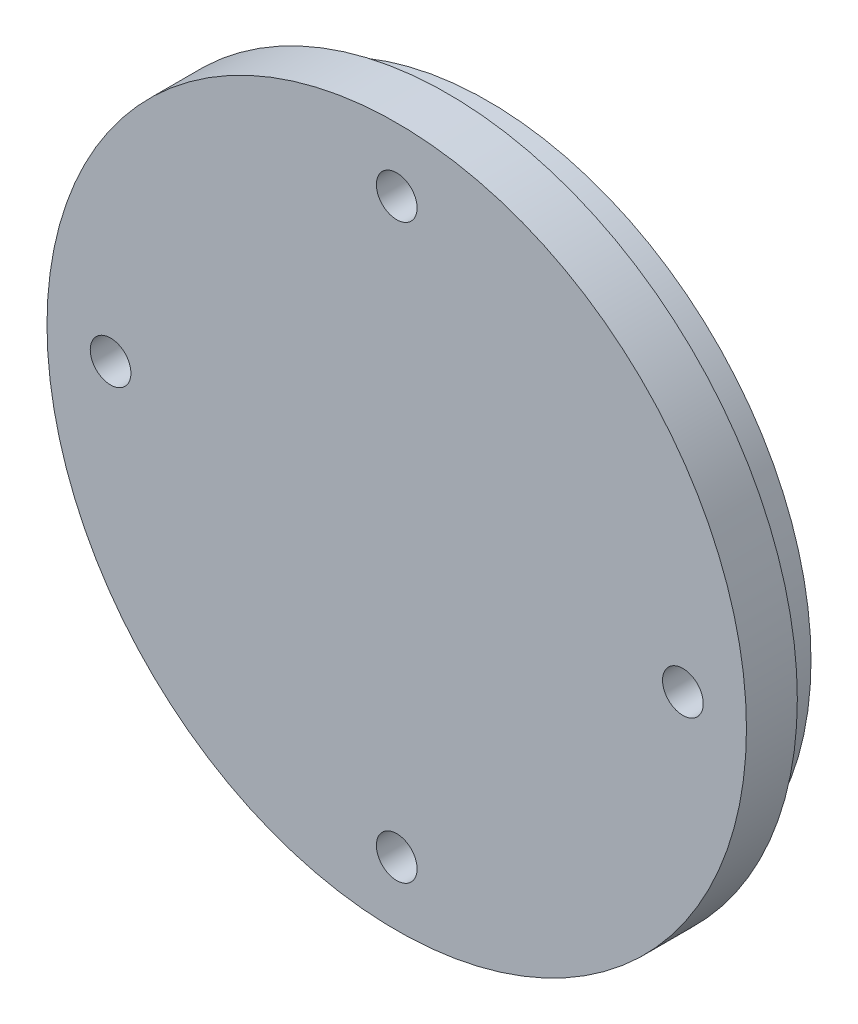
from build123d import *

# Parameters (mm, degrees)
SKETCH_1_R          = 27.5
EXTRUDE_1_DEPTH     = 4
SKETCH_2_R          = 25.4
EXTRUDE_2_DEPTH     = 3.175
SKETCH_3_R          = 1.6
CUT_EXTRUDE_1_DEPTH = 40.547194907


with BuildPart() as part:
    # ｽｹｯﾁ1 → ﾎﾞｽ - 押し出し1 (new body)
    with BuildSketch(Plane.XY):
        Circle(SKETCH_1_R)
    extrude(amount=EXTRUDE_1_DEPTH)

    # ｽｹｯﾁ2 → ﾎﾞｽ - 押し出し2 (add)
    with BuildSketch(Plane(origin=(0, 0, 0), x_dir=(-1, 0, 0), z_dir=(0, 0, -1))):
        Circle(SKETCH_2_R)
    extrude(amount=EXTRUDE_2_DEPTH)

    # ｽｹｯﾁ3 → ｶｯﾄ - 押し出し1 (cut, through all)
    with BuildSketch(Plane(origin=(0, 0, -3.175), x_dir=(-1, 0, 0), z_dir=(0, 0, -1))):
        with Locations((0, 22.5)):
            Circle(SKETCH_3_R)
        with Locations((22.5, 0)):
            Circle(SKETCH_3_R)
        with Locations((0, -22.5)):
            Circle(SKETCH_3_R)
        with Locations((-22.5, 0)):
            Circle(SKETCH_3_R)
    extrude(amount=-CUT_EXTRUDE_1_DEPTH, mode=Mode.SUBTRACT)


solid = part.part
